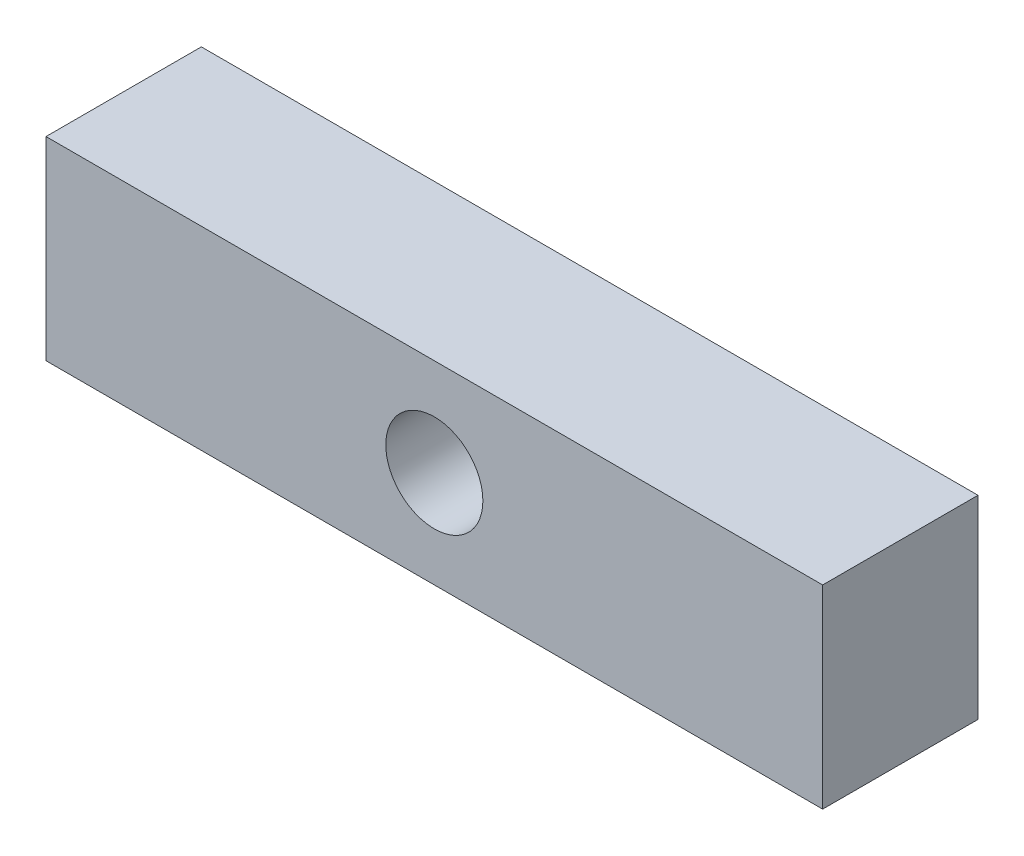
from build123d import *

# Parameters (mm, degrees)
SKETCH1_W           = 40
SKETCH1_H           = 10
SKETCH1_R           = 2.5
BOSS_EXTRUDE1_DEPTH = 8


with BuildPart() as part:
    # Sketch1 → Boss-Extrude1 (new body)
    with BuildSketch(Plane.XY):
        Rectangle(SKETCH1_W, SKETCH1_H)
        Circle(SKETCH1_R, mode=Mode.SUBTRACT)
    extrude(amount=BOSS_EXTRUDE1_DEPTH)


solid = part.part
